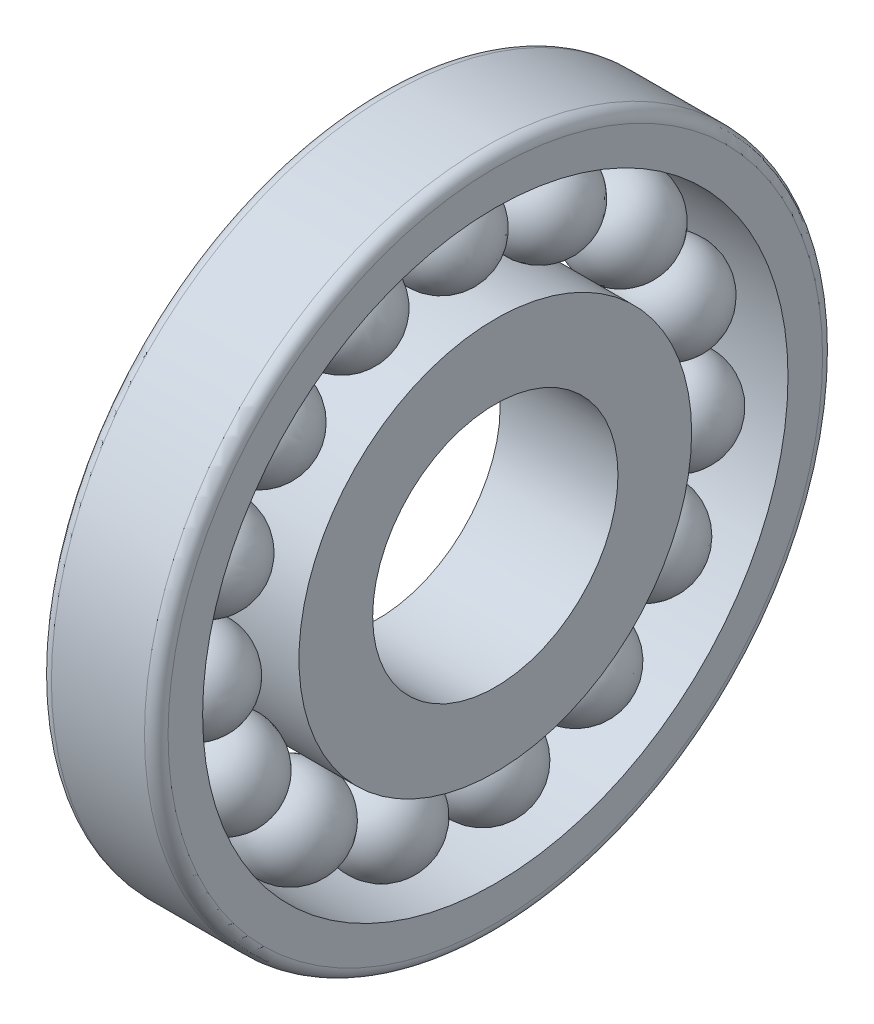
from build123d import *

# Parameters (mm, degrees)
SKETCH1_R           = 42.326781867
SKETCH1_R_2         = 26.442802171
BOSS_EXTRUDE1_DEPTH = 25.4
CIRPATTERN2_COUNT   = 15
SKETCH9_R           = 73.096618348
SKETCH9_R_2         = 63.103694666
BOSS_EXTRUDE2_DEPTH = 25.146
FILLET2_R           = 2.54


with BuildPart() as part:
    # Sketch1 → Boss-Extrude1 (new body)
    with BuildSketch(Plane(origin=(0, 0, 0), x_dir=(0, 0, -1), z_dir=(1, 0, 0))):
        Circle(SKETCH1_R)
        Circle(SKETCH1_R_2, mode=Mode.SUBTRACT)
    extrude(amount=BOSS_EXTRUDE1_DEPTH)

    # Sketch7 → Revolve4 (revolve)
    with BuildSketch(Plane(origin=(12.7, 0, 0), x_dir=(0, 0, -1), z_dir=(1, 0, 0))):
        with BuildLine():
            Line((31.093027848, 40.150150733), (48.040362858, 28.506077652))
            ThreePointArc((48.040362858, 28.506077652), (33.744658812, 25.854446688), (31.093027848, 40.150150733))
        make_face()
    revolve4 = revolve(axis=Axis((12.7, 40.150150733, -31.093027848), (0, -0.5662903727879052, -0.8242058078463992)))

    # CirPattern2: Revolve4 ×15 about axis
    cirpattern2_axis = Axis((0, 0, 0), (1, 0, 0))
    for i in range(1, CIRPATTERN2_COUNT):
        add(revolve4.rotate(cirpattern2_axis, i * 360 / CIRPATTERN2_COUNT))


with BuildPart() as body_2:
    # Sketch9 → Boss-Extrude2 (new body)
    with BuildSketch(Plane(origin=(25.4, 0, 0), x_dir=(0, 0, -1), z_dir=(1, 0, 0))):
        Circle(SKETCH9_R)
        Circle(SKETCH9_R_2, mode=Mode.SUBTRACT)
    extrude(amount=-BOSS_EXTRUDE2_DEPTH)

    # Fillet2
    fillet2_edges = [body_2.edges().sort_by_distance(p)[0] for p in [
        (25.4, 0, 73.096618348),
        (0.254, 0, 73.096618348),
    ]]
    fillet(fillet2_edges, radius=FILLET2_R)


solid = Compound([part.part, body_2.part])
